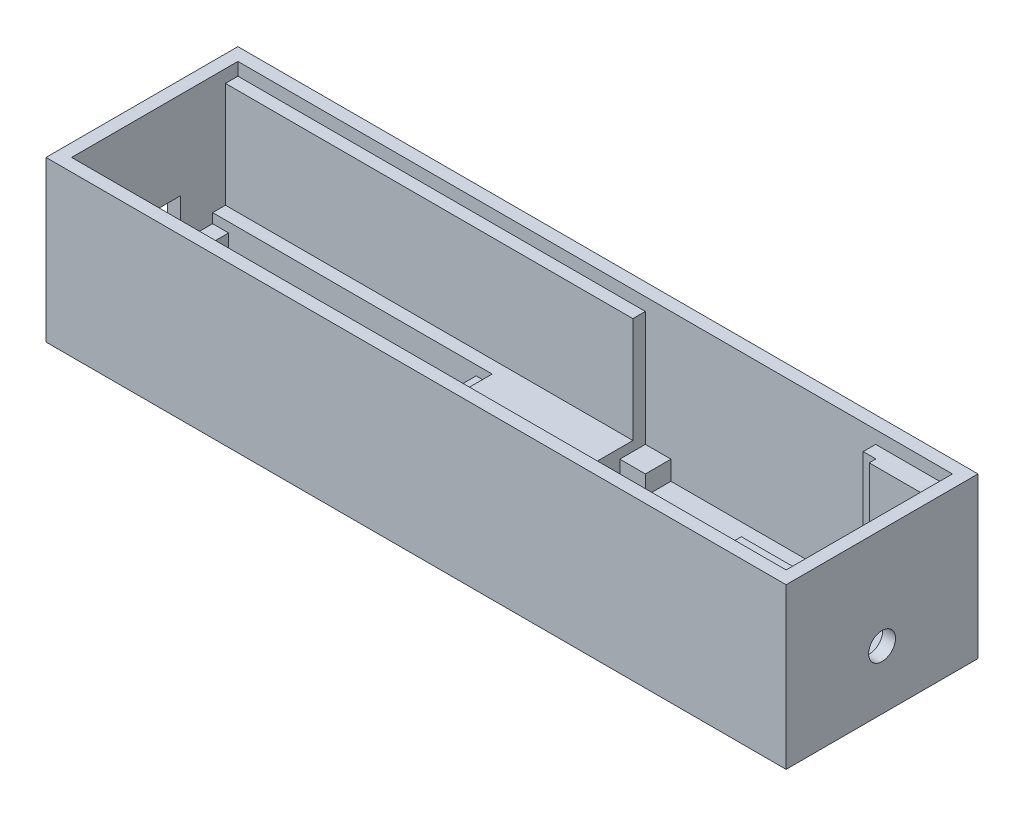
from build123d import *

# Parameters (mm, degrees)
ESQUISSE1_W             = 115.7
ESQUISSE1_H             = 30
ESQUISSE1_W_2           = 36
ESQUISSE1_H_2           = 26
ESQUISSE1_W_3           = 43.7
ESQUISSE1_H_3           = 18.1
ESQUISSE1_W_4           = 10
ESQUISSE1_H_4           = 20
BOSS_EXTRU_1_DEPTH      = 21
ESQUISSE2_W             = 115.7
ESQUISSE2_H             = 30
BOSS_EXTRU_2_DEPTH      = 2
ESQUISSE3_W             = 2.5
ESQUISSE3_H             = 2.5
BOSS_EXTRU_3_DEPTH      = 3
ESQUISSE4_W             = 4
ESQUISSE4_H             = 4
BOSS_EXTRU_4_DEPTH      = 3
ESQUISSE5_W             = 8
ESQUISSE5_H             = 4.2
ENL_V_MAT_EXTRU_1_DEPTH = 2
ESQUISSE7_W             = 101.7
ESQUISSE7_H             = 22.1
ENL_V_MAT_EXTRU_2_DEPTH = 16.5
ESQUISSE8_R             = 2.1
ENL_V_MAT_EXTRU_3_DEPTH = 2
ESQUISSE9_W             = 115.7
ESQUISSE9_H             = 30
ESQUISSE9_W_2           = 111.7
ESQUISSE9_H_2           = 26
BOSS_EXTRU_5_DEPTH      = 2


with BuildPart() as part:
    # Esquisse1 → Boss.-Extru.1 (new body)
    with BuildSketch(Plane(origin=(0, 0, 0), x_dir=(1, 0, 0), z_dir=(0, 1, 0))):
        with Locations((-7.85, 13)):
            Rectangle(ESQUISSE1_W, ESQUISSE1_H)
        with Locations((18, 13)):
            Rectangle(ESQUISSE1_W_2, ESQUISSE1_H_2, mode=Mode.SUBTRACT)
        with Locations((-41.85, 13)):
            Rectangle(ESQUISSE1_W_3, ESQUISSE1_H_3, mode=Mode.SUBTRACT)
        with Locations((43, 13)):
            Rectangle(ESQUISSE1_W_4, ESQUISSE1_H_4, mode=Mode.SUBTRACT)
    extrude(amount=BOSS_EXTRU_1_DEPTH)

    # Esquisse2 → Boss.-Extru.2 (add)
    with BuildSketch(Plane(origin=(0, 0, 0), x_dir=(-1, 0, 0), z_dir=(0, -1, 0))):
        with Locations((7.85, 13)):
            Rectangle(ESQUISSE2_W, ESQUISSE2_H)
    extrude(amount=BOSS_EXTRU_2_DEPTH)

    # Esquisse3 → Boss.-Extru.3 (add)
    with BuildSketch(Plane(origin=(0, 0, 0), x_dir=(1, 0, 0), z_dir=(0, 1, 0))):
        with Locations((-62.45, 20.8)):
            Rectangle(ESQUISSE3_W, ESQUISSE3_H)
        with Locations((-21.25, 20.8)):
            Rectangle(ESQUISSE3_W, ESQUISSE3_H)
        with Locations((-21.25, 5.2)):
            Rectangle(ESQUISSE3_W, ESQUISSE3_H)
        with Locations((-62.45, 5.2)):
            Rectangle(ESQUISSE3_W, ESQUISSE3_H)
    extrude(amount=BOSS_EXTRU_3_DEPTH)

    # Esquisse4 → Boss.-Extru.4 (add)
    with BuildSketch(Plane(origin=(0, 0, 0), x_dir=(1, 0, 0), z_dir=(0, 1, 0))):
        with Locations((2, 24)):
            Rectangle(ESQUISSE4_W, ESQUISSE4_H)
        with Locations((34, 24)):
            Rectangle(ESQUISSE4_W, ESQUISSE4_H)
        with Locations((34, 2)):
            Rectangle(ESQUISSE4_W, ESQUISSE4_H)
        with Locations((2, 2)):
            Rectangle(ESQUISSE4_W, ESQUISSE4_H)
    extrude(amount=BOSS_EXTRU_4_DEPTH)

    # Esquisse5 → Enlèv. mat.-Extru.1 (cut)
    with BuildSketch(Plane(origin=(-63.7, 0, 0), x_dir=(0, 0, -1), z_dir=(1, 0, 0))):
        with Locations((13, 7.2)):
            Rectangle(ESQUISSE5_W, ESQUISSE5_H)
    extrude(amount=-ENL_V_MAT_EXTRU_1_DEPTH, mode=Mode.SUBTRACT)

    # Esquisse7 → Enlèv. mat.-Extru.2 (cut)
    with BuildSketch(Plane(origin=(0, 4.5, 0), x_dir=(1, 0, 0), z_dir=(0, 1, 0))):
        with Locations((-12.85, 13)):
            Rectangle(ESQUISSE7_W, ESQUISSE7_H)
    extrude(amount=ENL_V_MAT_EXTRU_2_DEPTH, mode=Mode.SUBTRACT)

    # Esquisse8 → Enlèv. mat.-Extru.3 (cut)
    with BuildSketch(Plane.ZY.offset(-48)):
        with Locations((-13, 7.2)):
            Circle(ESQUISSE8_R)
    extrude(amount=-ENL_V_MAT_EXTRU_3_DEPTH, mode=Mode.SUBTRACT)

    # Esquisse9 → Boss.-Extru.5 (add)
    with BuildSketch(Plane(origin=(0, 21, 0), x_dir=(1, 0, 0), z_dir=(0, 1, 0))):
        with Locations((-7.85, 13)):
            Rectangle(ESQUISSE9_W, ESQUISSE9_H)
        with Locations((-7.85, 13)):
            Rectangle(ESQUISSE9_W_2, ESQUISSE9_H_2, mode=Mode.SUBTRACT)
    extrude(amount=BOSS_EXTRU_5_DEPTH)


solid = part.part
